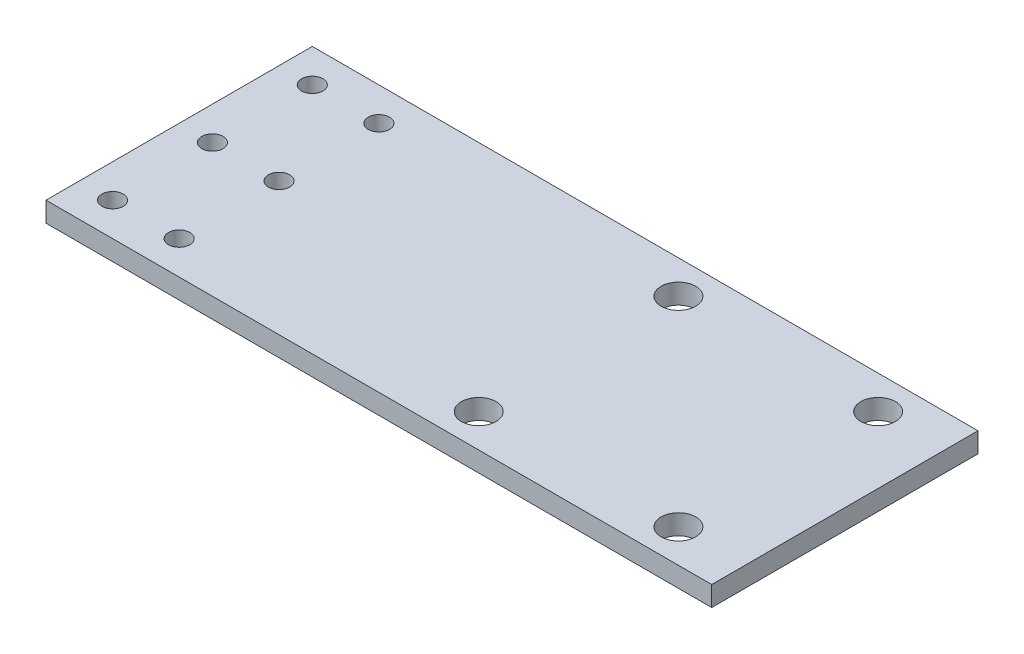
from build123d import *

# Parameters (mm, degrees)
SKETCH_1_W          = 100
SKETCH_1_H          = 40
SKETCH_1_R          = 1.6
EXTRUDE_1_DEPTH     = 3
SKETCH_2_R          = 2.6
CUT_EXTRUDE_1_DEPTH = 3


with BuildPart() as part:
    # 草图1 → 凸台-拉伸1 (new body)
    with BuildSketch(Plane(origin=(0, 0, 0), x_dir=(1, 0, 0), z_dir=(0, 1, 0))):
        with Locations((50, -20)):
            Rectangle(SKETCH_1_W, SKETCH_1_H)
        with Locations(Location((5, -20, 0), (0, 0, 270))):
            Circle(SKETCH_1_R, mode=Mode.SUBTRACT)
        with Locations(Location((5, -5, 0), (0, 0, 270))):
            Circle(SKETCH_1_R, mode=Mode.SUBTRACT)
        with Locations(Location((15, -20, 0), (0, 0, 90))):
            Circle(SKETCH_1_R, mode=Mode.SUBTRACT)
        with Locations(Location((15, -5, 0), (0, 0, 90))):
            Circle(SKETCH_1_R, mode=Mode.SUBTRACT)
        with Locations(Location((15, -35, 0), (0, 0, 270))):
            Circle(SKETCH_1_R, mode=Mode.SUBTRACT)
        with Locations(Location((5, -35, 0), (0, 0, 90))):
            Circle(SKETCH_1_R, mode=Mode.SUBTRACT)
    extrude(amount=EXTRUDE_1_DEPTH)

    # 草图2 → 切除-拉伸1 (cut)
    with BuildSketch(Plane(origin=(0, 3, 0), x_dir=(1, 0, 0), z_dir=(0, 1, 0))):
        with Locations(Location((60, -5, 0), (0, 0, 270))):
            Circle(SKETCH_2_R)
        with Locations(Location((60, -35, 0), (0, 0, 90))):
            Circle(SKETCH_2_R)
        with Locations(Location((90, -35, 0), (0, 0, 270))):
            Circle(SKETCH_2_R)
        with Locations(Location((90, -5, 0), (0, 0, 90))):
            Circle(SKETCH_2_R)
    extrude(amount=-CUT_EXTRUDE_1_DEPTH, mode=Mode.SUBTRACT)


solid = part.part
